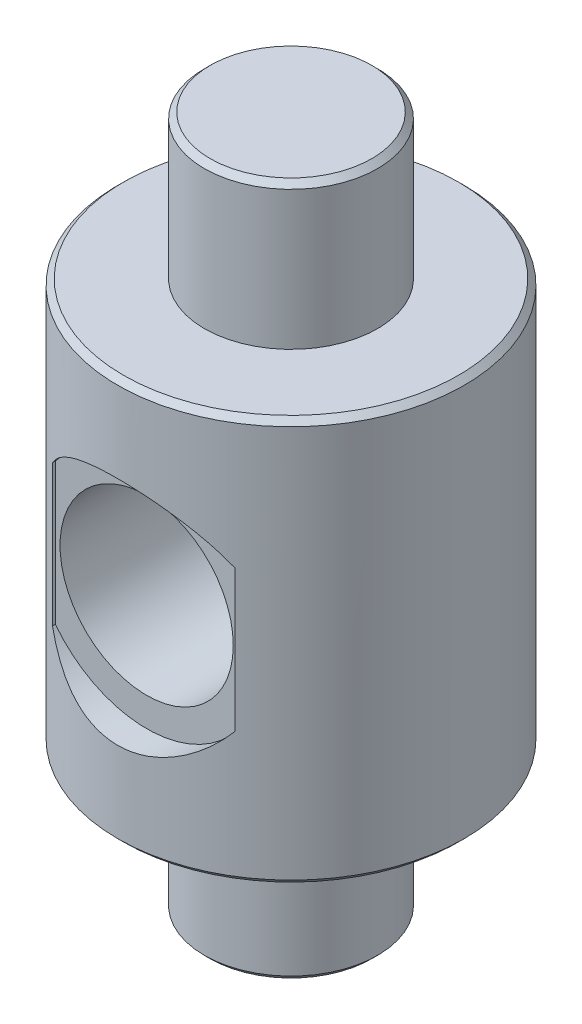
from build123d import *

# Parameters (mm, degrees)
SKETCH1_R           = 1.5
BOSS_EXTRUDE1_DEPTH = 6
SKETCH2_R           = 3
BOSS_EXTRUDE2_DEPTH = 3.5
CUT_EXTRUDE1_DEPTH  = 0.5
SKETCH3_3_R         = 1.5
CUT_EXTRUDE2_DEPTH  = 10.0000001
CHAMFER1_SIZE       = 0.1


with BuildPart() as part:
    # Sketch1 → Boss-Extrude1 (new, symmetric)
    with BuildSketch(Plane(origin=(0, 0, 0), x_dir=(1, 0, 0), z_dir=(0, 1, 0))):
        Circle(SKETCH1_R)
    extrude(amount=BOSS_EXTRUDE1_DEPTH, both=True)

    # Sketch2 → Boss-Extrude2 (add, symmetric)
    with BuildSketch(Plane(origin=(0, 0, 0), x_dir=(1, 0, 0), z_dir=(0, 1, 0))):
        Circle(SKETCH2_R)
    extrude(amount=BOSS_EXTRUDE2_DEPTH, both=True)

    # Sketch3 → Cut-Extrude1 (cut)
    with BuildSketch(Plane.XY.offset(3)):
        with BuildLine():
            Line((1.581457004, 1.224334), (1.581457004, -1.224334))
            ThreePointArc((1.581457004, -1.224334), (0, -2), (-1.581457004, -1.224334))
            Line((-1.581457004, -1.224334), (-1.581457004, 1.224334))
            ThreePointArc((-1.581457004, 1.224334), (0, 2), (1.581457004, 1.224334))
        make_face()
    cut_extrude1 = extrude(amount=-CUT_EXTRUDE1_DEPTH, mode=Mode.SUBTRACT)

    # Sketch3<3> → Cut-Extrude2 (cut, through all)
    with BuildSketch(Plane.XY.offset(3)):
        Circle(SKETCH3_3_R)
    extrude(amount=-CUT_EXTRUDE2_DEPTH, mode=Mode.SUBTRACT)

    # Mirror1: Cut-Extrude1 across plane
    add(cut_extrude1.mirror(Plane.XY), mode=Mode.SUBTRACT)

    # Chamfer1
    chamfer1_edges = [part.edges().sort_by_distance(p)[0] for p in [
        (-1.5, 6, 0),
        (-1.5, -6, 0),
        (-3, -3.5, 0),
        (-3, 3.5, 0),
    ]]
    chamfer(chamfer1_edges, length=CHAMFER1_SIZE)


solid = part.part
